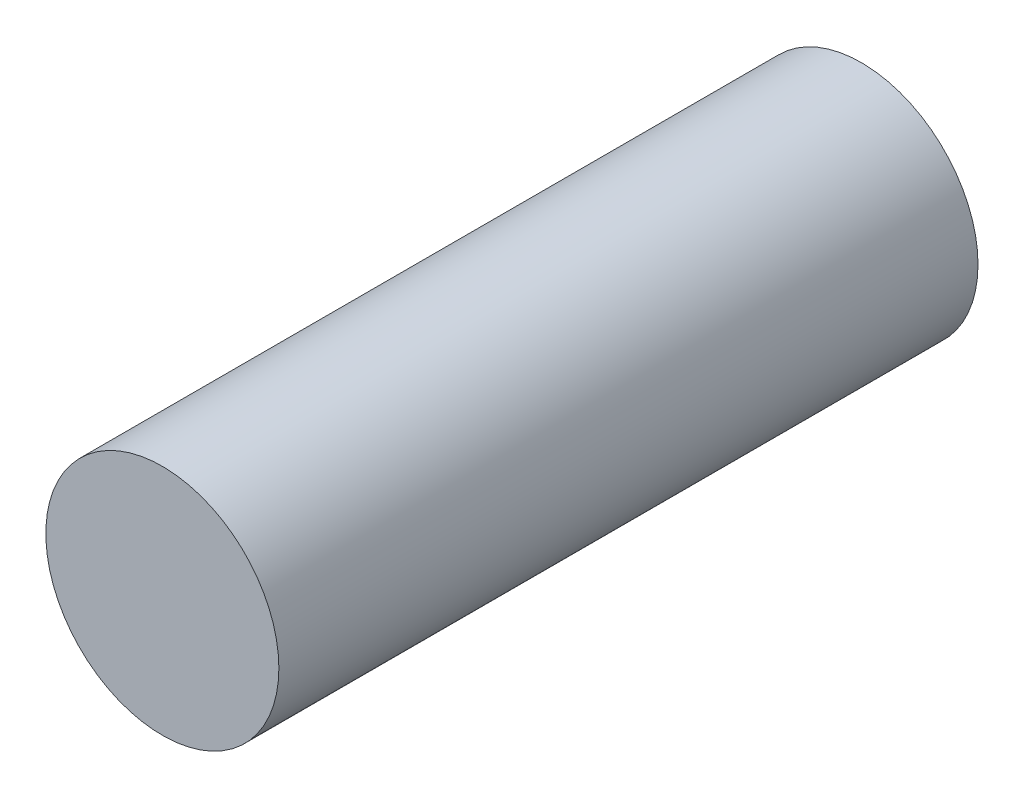
from build123d import *

# Parameters (mm, degrees)
SKETCH_1_R      = 10
EXTRUDE_1_DEPTH = 60


with BuildPart() as part:
    # 草图1 → 凸台-拉伸1 (new body)
    with BuildSketch(Plane.XY):
        Circle(SKETCH_1_R)
    extrude(amount=EXTRUDE_1_DEPTH)


solid = part.part
